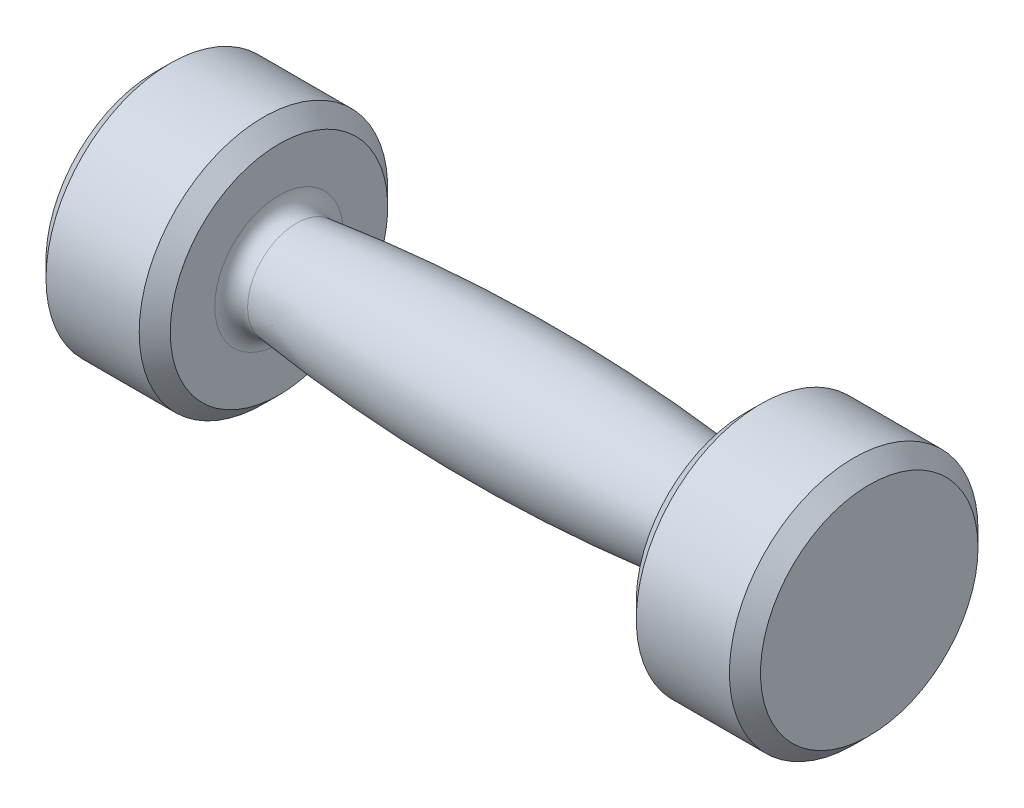
from build123d import *

# Parameters (mm, degrees)
SKETCH5_R           = 15
BOSS_EXTRUDE1_DEPTH = 115
SKETCH6_R           = 40
BOSS_EXTRUDE2_DEPTH = 40
BOSS_EXTRUDE3_START = -40
SKETCH7_R           = 40
BOSS_EXTRUDE3_DEPTH = 40
FILLET2_R           = 5
CHAMFER1_SIZE       = 5


with BuildPart() as part:
    # Sketch5 → Boss-Extrude1 (new, symmetric)
    with BuildSketch(Plane(origin=(0, 0, 0), x_dir=(0, 0, -1), z_dir=(1, 0, 0))):
        Circle(SKETCH5_R)
    extrude(amount=BOSS_EXTRUDE1_DEPTH, both=True)

    # Sketch6 → Boss-Extrude2 (add)
    with BuildSketch(Plane(origin=(115, 0, 0), x_dir=(0, 0, -1), z_dir=(1, 0, 0))):
        Circle(SKETCH6_R)
    extrude(amount=-BOSS_EXTRUDE2_DEPTH)

    # Sketch7 → Boss-Extrude3 (add)
    with BuildSketch(Plane.ZY.offset(115).offset(BOSS_EXTRUDE3_START)):
        with Locations(Location((0, 0, 0), (0, 0, 180))):
            Circle(SKETCH7_R)
    extrude(amount=BOSS_EXTRUDE3_DEPTH)

    # Sketch9 → Revolve1 (revolve)
    with BuildSketch(Plane.XY, mode=Mode.PRIVATE) as revolve1_sk:
        with BuildLine():
            Line((-75, 15), (75, 15))
            ThreePointArc((75, 15), (0, 20), (-75, 15))
        make_face()
    revolve(revolve1_sk.sketch.rotate(Axis((0, 0, 0), (-1, 0, 0)), 90), axis=Axis((0, 0, 0), (-1, 0, 0)))

    # Fillet2
    fillet2_edges = [part.edges().sort_by_distance(p)[0] for p in [
        (-75, 0, 15),
        (75, 0, 15),
    ]]
    fillet(fillet2_edges, radius=FILLET2_R)

    # Chamfer1
    chamfer1_edges = [part.edges().sort_by_distance(p)[0] for p in [
        (-75, 0, 40),
        (-115, 0, 40),
        (75, 0, 40),
        (115, 0, 40),
    ]]
    chamfer(chamfer1_edges, length=CHAMFER1_SIZE)


solid = part.part
